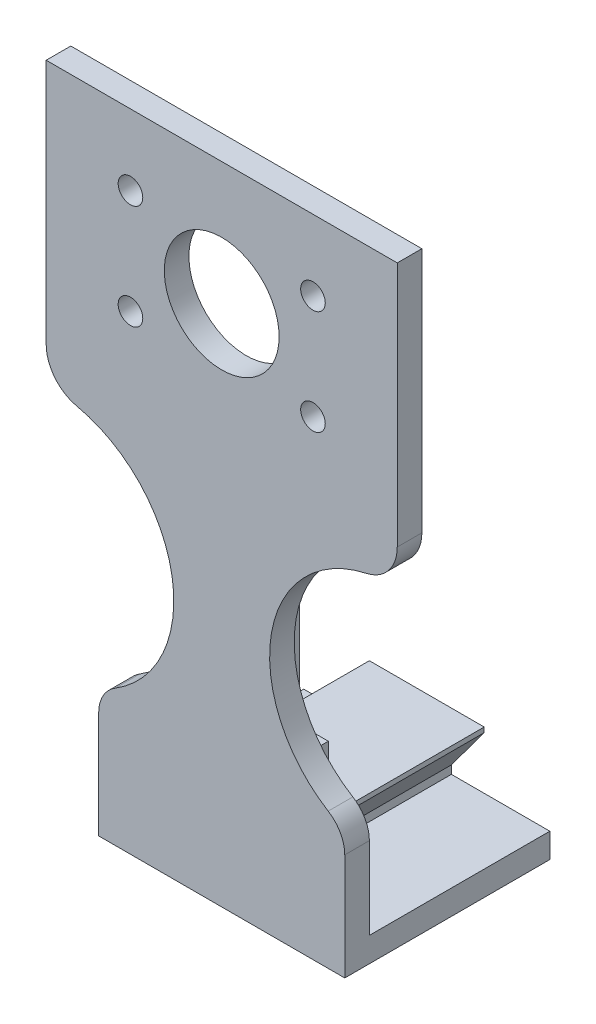
from build123d import *

# Parameters (mm, degrees)
SCHIZZO1_R                   = 1.5
SCHIZZO1_R_2                 = 7
ESTRUSIONE_ESTRUSIONE1_DEPTH = 3
ESTRUSIONE_ESTRUSIONE2_DEPTH = 22
ESTRUSIONE_ESTRUSIONE3_DEPTH = 5


with BuildPart() as part:
    # Schizzo1 → Estrusione-Estrusione1 (new body)
    with BuildSketch(Plane.XY):
        with BuildLine():
            Line((-162.593868151, -125.596865141), (-132.593868151, -125.596865141))
            Line((-132.593868151, -125.596865141), (-132.593868151, -112.596865141))
            ThreePointArc((-132.593868151, -112.596865141), (-133.132467042, -110.529315323), (-134.611355423, -108.98732305))
            ThreePointArc((-134.611355423, -108.98732305), (-141.540233609, -93.695971479), (-129.946074176, -81.554709072))
            ThreePointArc((-129.946074176, -81.554709072), (-127.248599586, -79.887457063), (-126.193868151, -76.896865144))
            Line((-126.193868151, -76.896865144), (-126.193868151, -46.896865141))
            Line((-126.193868151, -46.896865141), (-168.993868151, -46.896865141))
            Line((-168.993868151, -46.896865141), (-168.993868151, -76.896865144))
            ThreePointArc((-168.993868151, -76.896865144), (-167.939136717, -79.887457063), (-165.241662126, -81.554709072))
            ThreePointArc((-165.241662126, -81.554709072), (-153.647502693, -93.695971479), (-160.576380879, -108.98732305))
            ThreePointArc((-160.576380879, -108.98732305), (-162.055269261, -110.529315323), (-162.593868151, -112.596865141))
            Line((-162.593868151, -112.596865141), (-162.593868151, -125.596865141))
        make_face()
        with Locations((-136.468868151, -55.521865143)):
            Circle(SCHIZZO1_R, mode=Mode.SUBTRACT)
        with Locations((-158.718868151, -68.271865143)):
            Circle(SCHIZZO1_R, mode=Mode.SUBTRACT)
        with Locations((-158.718868151, -55.521865143)):
            Circle(SCHIZZO1_R, mode=Mode.SUBTRACT)
        with Locations((-136.468868151, -68.271865143)):
            Circle(SCHIZZO1_R, mode=Mode.SUBTRACT)
        with Locations((-147.593868151, -61.896865143)):
            Circle(SCHIZZO1_R_2, mode=Mode.SUBTRACT)
    extrude(amount=ESTRUSIONE_ESTRUSIONE1_DEPTH)

    # Schizzo2 → Estrusione-Estrusione2 (add)
    with BuildSketch(Plane(origin=(0, 0, 0), x_dir=(-1, 0, 0), z_dir=(0, 0, -1))):
        Polygon((150.593868151, -122.596865141), (150.593868151, -121.596865141), (154.593868151, -116.196865141), (154.593868151, -115.596865141), (140.593868151, -115.596865141), (140.593868151, -116.196865141), (144.593868151, -121.596865141), (144.593868151, -122.596865141), (132.593868151, -122.596865141), (132.593868151, -125.596865141), (162.593868151, -125.596865141), (162.593868151, -122.596865141), align=None)
    extrude(amount=ESTRUSIONE_ESTRUSIONE2_DEPTH)

    # Schizzo3 → Estrusione-Estrusione3 (add)
    with BuildSketch(Plane(origin=(0, 0, 0), x_dir=(-1, 0, 0), z_dir=(0, 0, -1))):
        Polygon((142.593868151, -112.596865141), (152.593868151, -112.596865141), (152.593868151, -109.596865141), (149.093868151, -109.596865141), (149.093868151, -88.096865141), (146.093868151, -88.096865141), (146.093868151, -109.596865141), (142.593868151, -109.596865141), align=None)
    extrude(amount=ESTRUSIONE_ESTRUSIONE3_DEPTH)


solid = part.part
